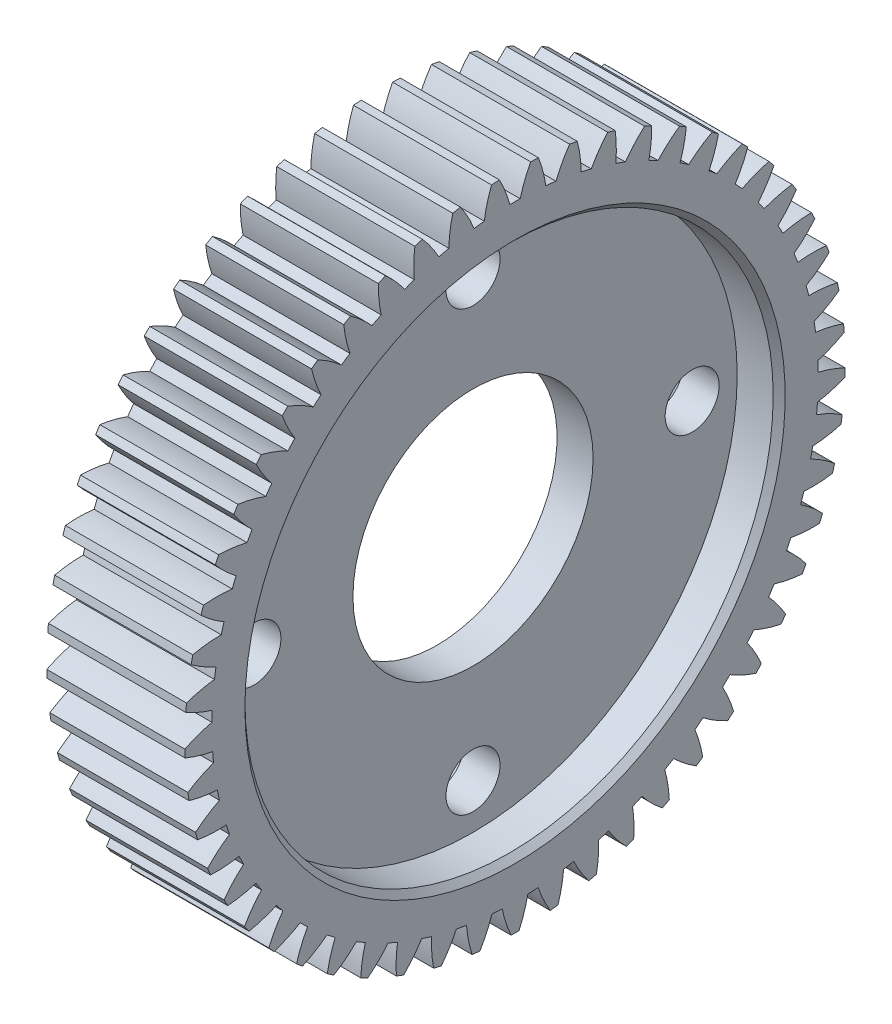
from build123d import *

# Parameters (mm, degrees)
BASPROSKE_W              = 23
BASPROSKE_H              = 55
TOOTHCUT_DEPTH           = 82.111035008
TEETHCUTS_COUNT          = 53
TEETHCUTS_ANGLE          = 353.20754717
BORSKE_R                 = 20
BORE_DEPTH               = 50.0000508
SKETCH1_R                = 44
CUT_EXTRUDE1_DEPTH       = 7
CHAMFER1_SIZE            = 1
SKETCH2_R                = 48
CUT_EXTRUDE2_DEPTH       = 10
FILLET1_R                = 2
F_9_0_9_DIAMETER_HOLE1_D = 9
CIRPATTERN1_COUNT        = 4


with BuildPart() as part:
    # BasProSke → Base-Revolve (revolve)
    with BuildSketch(Plane(origin=(0, 0, 0), x_dir=(1, 0, 0), z_dir=(0, 1, 0)), mode=Mode.PRIVATE) as base_revolve_sk:
        with Locations((11.5, 27.5)):
            Rectangle(BASPROSKE_W, BASPROSKE_H)
    revolve(base_revolve_sk.sketch.rotate(Axis((-10, 0, 0), (1, 0, 0)), 180), axis=Axis((-10, 0, 0), (1, 0, 0)))

    # TooCutSke → ToothCut (cut, through all)
    with BuildSketch(Plane(origin=(0, 0, 0), x_dir=(0, 0, -1), z_dir=(1, 0, 0))):
        with BuildLine():
            ThreePointArc((0.855513517, 50.491752768), (0, 50.499), (-0.855513517, 50.491752768))
            ThreePointArc((-0.855513517, 50.491752768), (-1.609590074, 52.777525332), (-2.617903618, 54.963089668))
            ThreePointArc((-2.617903618, 54.963089668), (0, 55.0254), (2.617903618, 54.963089668))
            ThreePointArc((2.617903618, 54.963089668), (1.609590074, 52.777525332), (0.855513517, 50.491752768))
        make_face()
    toothcut = extrude(amount=TOOTHCUT_DEPTH, mode=Mode.SUBTRACT)

    # TeethCuts: ToothCut ×53 about axis
    teethcuts_axis = Axis((-10, 0, 0), (1, 0, 0))
    for i in range(1, TEETHCUTS_COUNT):
        add(toothcut.rotate(teethcuts_axis, i * TEETHCUTS_ANGLE / (TEETHCUTS_COUNT - 1)), mode=Mode.SUBTRACT)

    # BorSke → Bore (cut, symmetric)
    with BuildSketch(Plane(origin=(0, 0, 0), x_dir=(0, 0, -1), z_dir=(1, 0, 0))):
        with Locations(Location((0, 0, 0), (0, 0, 180))):
            Circle(BORSKE_R)
    extrude(amount=BORE_DEPTH, both=True, mode=Mode.SUBTRACT)

    # Sketch1 → Cut-Extrude1 (cut)
    with BuildSketch(Plane(origin=(23, 0, 0), x_dir=(0, 0, -1), z_dir=(1, 0, 0))):
        Circle(SKETCH1_R)
    extrude(amount=-CUT_EXTRUDE1_DEPTH, mode=Mode.SUBTRACT)

    # Chamfer1
    chamfer1_edges = [part.edges().sort_by_distance(p)[0] for p in [
        (23, 0, 44),
    ]]
    chamfer(chamfer1_edges, length=CHAMFER1_SIZE)

    # Sketch2 → Cut-Extrude2 (cut)
    with BuildSketch(Plane.ZY):
        Circle(SKETCH2_R)
    extrude(amount=-CUT_EXTRUDE2_DEPTH, mode=Mode.SUBTRACT)

    # Fillet1
    fillet1_edges = [part.edges().sort_by_distance(p)[0] for p in [
        (10, 0, -48),
    ]]
    fillet(fillet1_edges, radius=FILLET1_R)

    # Ø9.0 (9) Diameter Hole1 (through all)
    with Locations(Plane.ZY.offset(-10)):
        with Locations((0, 36.5)):
            f_9_0_9_diameter_hole1 = Hole(F_9_0_9_DIAMETER_HOLE1_D / 2)

    # CirPattern1: Ø9.0 (9) Diameter Hole1 ×4 about axis
    cirpattern1_axis = Axis((0, 0, 0), (1, 0, 0))
    for i in range(1, CIRPATTERN1_COUNT):
        add(f_9_0_9_diameter_hole1.rotate(cirpattern1_axis, i * 360 / CIRPATTERN1_COUNT), mode=Mode.SUBTRACT)


solid = part.part
